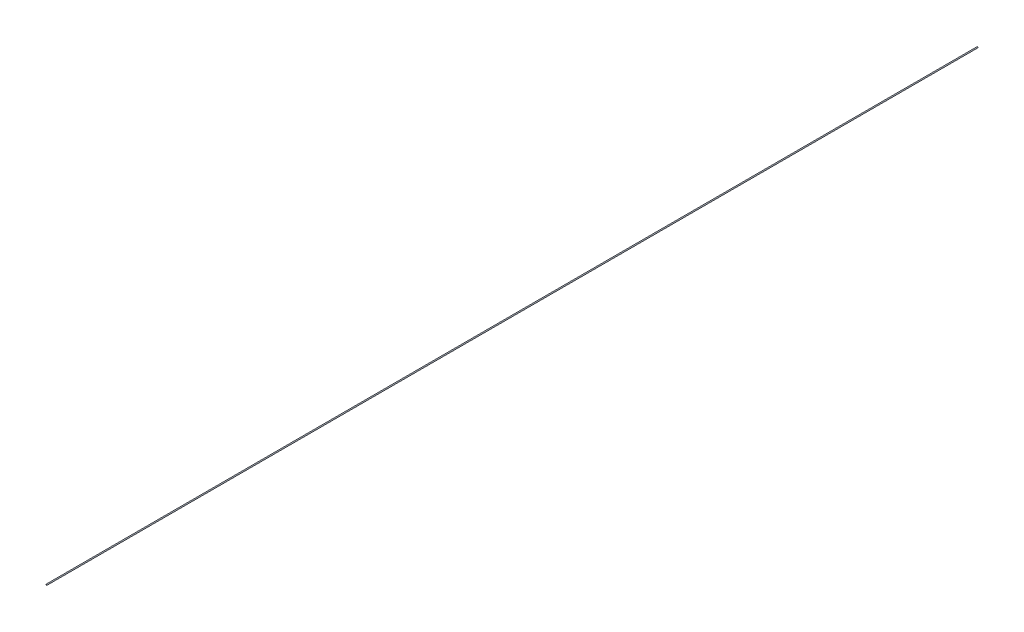
from build123d import *

# Parameters (mm, degrees)
SKETCH_1_R      = 0.6
EXTRUDE_1_DEPTH = 1092.962


with BuildPart() as part:
    # 草图1 → 凸台-拉伸1 (new body)
    with BuildSketch(Plane.XY):
        Circle(SKETCH_1_R)
    extrude(amount=EXTRUDE_1_DEPTH)


solid = part.part
